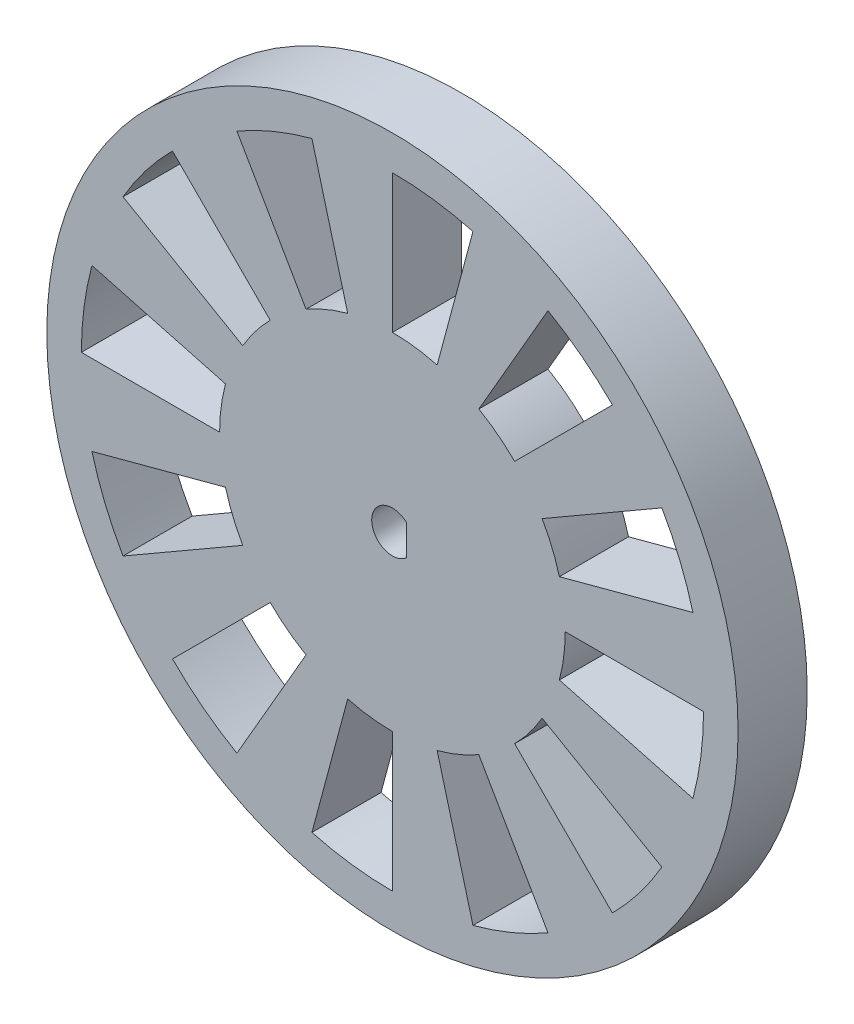
from build123d import *

# Parameters (mm, degrees)
SKETCH_2_R      = 25
EXTRUDE_1_DEPTH = 5


with BuildPart() as part:
    # 草圖2 → 填料-伸長1 (new body)
    with BuildSketch(Plane.XY):
        Circle(SKETCH_2_R)
        with BuildLine():
            Line((0, 12.5), (0, 22.5))
            ThreePointArc((0, 22.5), (2.936839325, 22.307509381), (5.823428515, 21.733331092))
            Line((5.823428515, 21.733331092), (3.235238064, 12.074072829))
            ThreePointArc((3.235238064, 12.074072829), (1.631577403, 12.393060767), (0, 12.5))
        make_face(mode=Mode.SUBTRACT)
        with BuildLine():
            Line((6.25, 10.825317547), (11.25, 19.485571585))
            ThreePointArc((11.25, 19.485571585), (13.697132153, 17.850450157), (15.909902577, 15.909902577))
            Line((15.909902577, 15.909902577), (8.838834765, 8.838834765))
            ThreePointArc((8.838834765, 8.838834765), (7.609517863, 9.916916754), (6.25, 10.825317547))
        make_face(mode=Mode.SUBTRACT)
        with BuildLine():
            Line((10.825317547, 6.25), (19.485571585, 11.25))
            ThreePointArc((19.485571585, 11.25), (20.787289482, 8.610377228), (21.733331092, 5.823428515))
            Line((21.733331092, 5.823428515), (12.074072829, 3.235238064))
            ThreePointArc((12.074072829, 3.235238064), (11.548494156, 4.783542905), (10.825317547, 6.25))
        make_face(mode=Mode.SUBTRACT)
        with BuildLine():
            Line((12.5, 0), (22.5, 0))
            ThreePointArc((22.5, 0), (22.307509381, -2.936839325), (21.733331092, -5.823428515))
            Line((21.733331092, -5.823428515), (12.074072829, -3.235238064))
            ThreePointArc((12.074072829, -3.235238064), (12.393060767, -1.631577403), (12.5, 0))
        make_face(mode=Mode.SUBTRACT)
        with BuildLine():
            Line((10.825317547, -6.25), (19.485571585, -11.25))
            ThreePointArc((19.485571585, -11.25), (17.850450157, -13.697132153), (15.909902577, -15.909902577))
            Line((15.909902577, -15.909902577), (8.838834765, -8.838834765))
            ThreePointArc((8.838834765, -8.838834765), (9.916916754, -7.609517863), (10.825317547, -6.25))
        make_face(mode=Mode.SUBTRACT)
        with BuildLine():
            Line((6.25, -10.825317547), (11.25, -19.485571585))
            ThreePointArc((11.25, -19.485571585), (8.610377228, -20.787289482), (5.823428515, -21.733331092))
            Line((5.823428515, -21.733331092), (3.235238064, -12.074072829))
            ThreePointArc((3.235238064, -12.074072829), (4.783542905, -11.548494156), (6.25, -10.825317547))
        make_face(mode=Mode.SUBTRACT)
        with BuildLine():
            Line((0, -12.5), (0, -22.5))
            ThreePointArc((0, -22.5), (-2.936839325, -22.307509381), (-5.823428515, -21.733331092))
            Line((-5.823428515, -21.733331092), (-3.235238064, -12.074072829))
            ThreePointArc((-3.235238064, -12.074072829), (-1.631577403, -12.393060767), (0, -12.5))
        make_face(mode=Mode.SUBTRACT)
        with BuildLine():
            Line((-6.25, -10.825317547), (-11.25, -19.485571585))
            ThreePointArc((-11.25, -19.485571585), (-13.697132153, -17.850450157), (-15.909902577, -15.909902577))
            Line((-15.909902577, -15.909902577), (-8.838834765, -8.838834765))
            ThreePointArc((-8.838834765, -8.838834765), (-7.609517863, -9.916916754), (-6.25, -10.825317547))
        make_face(mode=Mode.SUBTRACT)
        with BuildLine():
            Line((-10.825317547, -6.25), (-19.485571585, -11.25))
            ThreePointArc((-19.485571585, -11.25), (-20.787289482, -8.610377228), (-21.733331092, -5.823428515))
            Line((-21.733331092, -5.823428515), (-12.074072829, -3.235238064))
            ThreePointArc((-12.074072829, -3.235238064), (-11.548494156, -4.783542905), (-10.825317547, -6.25))
        make_face(mode=Mode.SUBTRACT)
        with BuildLine():
            Line((-12.5, 0), (-22.5, 0))
            ThreePointArc((-22.5, 0), (-22.307509381, 2.936839325), (-21.733331092, 5.823428515))
            Line((-21.733331092, 5.823428515), (-12.074072829, 3.235238064))
            ThreePointArc((-12.074072829, 3.235238064), (-12.393060767, 1.631577403), (-12.5, 0))
        make_face(mode=Mode.SUBTRACT)
        with BuildLine():
            Line((-10.825317547, 6.25), (-19.485571585, 11.25))
            ThreePointArc((-19.485571585, 11.25), (-17.850450157, 13.697132153), (-15.909902577, 15.909902577))
            Line((-15.909902577, 15.909902577), (-8.838834765, 8.838834765))
            ThreePointArc((-8.838834765, 8.838834765), (-9.916916754, 7.609517863), (-10.825317547, 6.25))
        make_face(mode=Mode.SUBTRACT)
        with BuildLine():
            Line((-6.25, 10.825317547), (-11.25, 19.485571585))
            ThreePointArc((-11.25, 19.485571585), (-8.610377228, 20.787289482), (-5.823428515, 21.733331092))
            Line((-5.823428515, 21.733331092), (-3.235238064, 12.074072829))
            ThreePointArc((-3.235238064, 12.074072829), (-4.783542905, 11.548494156), (-6.25, 10.825317547))
        make_face(mode=Mode.SUBTRACT)
        with BuildLine():
            Line((1, -1.118033989), (1, 1.118033989))
            ThreePointArc((1, 1.118033989), (-1.5, 0), (1, -1.118033989))
        make_face(mode=Mode.SUBTRACT)
    extrude(amount=EXTRUDE_1_DEPTH)


solid = part.part
